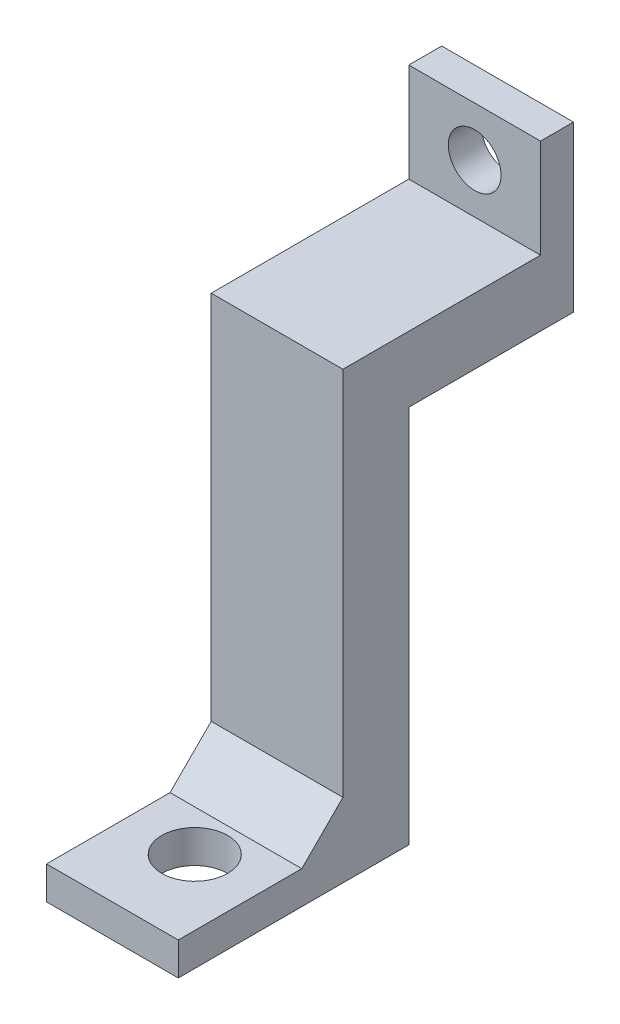
from build123d import *

# Parameters (mm, degrees)
BOSS_EXTRUDE1_DEPTH = 8
SKETCH3_R           = 1.6
CUT_EXTRUDE1_DEPTH  = 10
SKETCH4_R           = 2
CUT_EXTRUDE2_DEPTH  = 10


with BuildPart() as part:
    # Sketch1 → Boss-Extrude1 (new body)
    with BuildSketch(Plane(origin=(0, 0, 0), x_dir=(0, 0, -1), z_dir=(1, 0, 0))):
        Polygon((70.223325062, 25.017667028), (82.223325062, 25.017667028), (82.223325062, 31.017667028), (84.223325062, 31.017667028), (84.223325062, 21.017667028), (74.223325062, 21.017667028), (74.223325062, -2), (70.223325062, -2), (60.223325062, -2), (60.223325062, 0), (67.723325062, 0), (70.223325062, 2.5), align=None)
    extrude(amount=BOSS_EXTRUDE1_DEPTH)

    # Sketch3 → Cut-Extrude1 (cut)
    with BuildSketch(Plane.XY.offset(-82.223325062)):
        with Locations((4, 28.017667028)):
            Circle(SKETCH3_R)
    extrude(amount=-CUT_EXTRUDE1_DEPTH, mode=Mode.SUBTRACT)

    # Sketch4 → Cut-Extrude2 (cut)
    with BuildSketch(Plane(origin=(0, 0, 0), x_dir=(1, 0, 0), z_dir=(0, 1, 0))):
        with Locations(Location((4, 65.223325062, 0), (0, 0, 270))):
            Circle(SKETCH4_R)
    extrude(amount=-CUT_EXTRUDE2_DEPTH, mode=Mode.SUBTRACT)


solid = part.part
